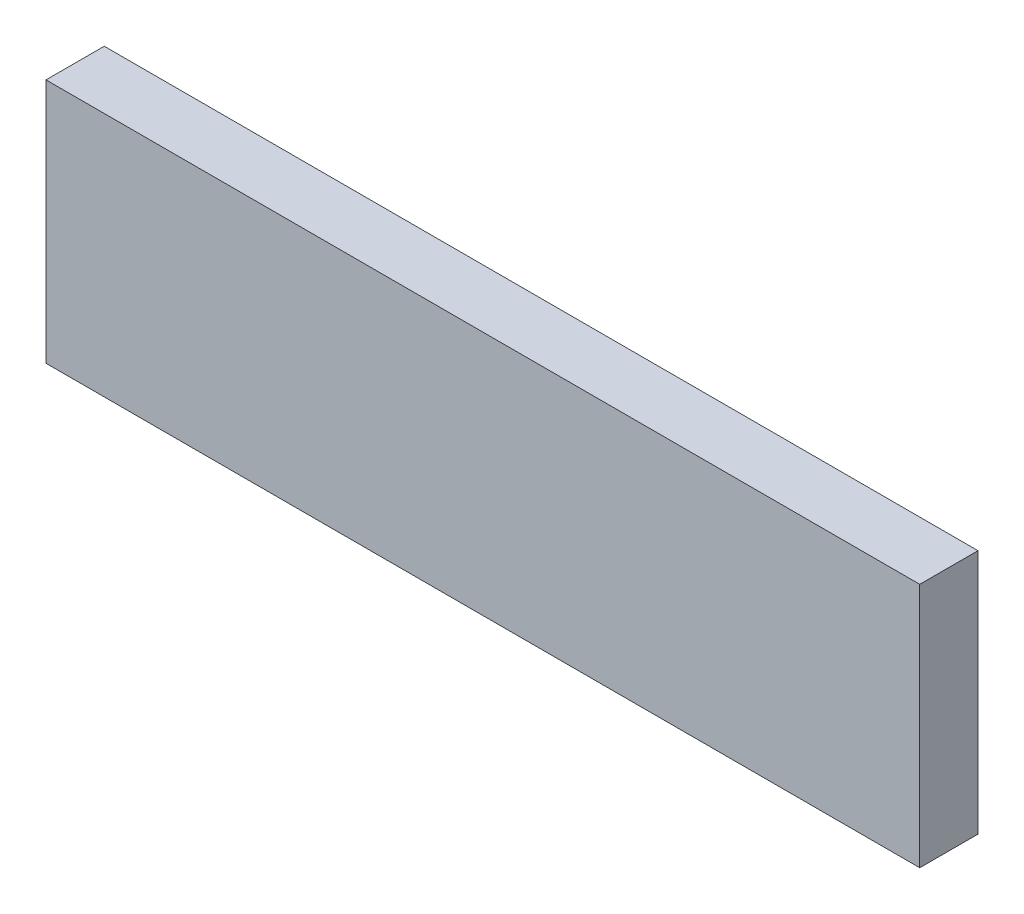
from build123d import *

# Parameters (mm, degrees)
SKETCH_1_W      = 105
SKETCH_1_H      = 29.5
EXTRUDE_1_DEPTH = 7


with BuildPart() as part:
    # 草图1 → 凸台-拉伸1 (new body)
    with BuildSketch(Plane.XY):
        with Locations((52.5, -14.75)):
            Rectangle(SKETCH_1_W, SKETCH_1_H)
    extrude(amount=EXTRUDE_1_DEPTH)


solid = part.part
